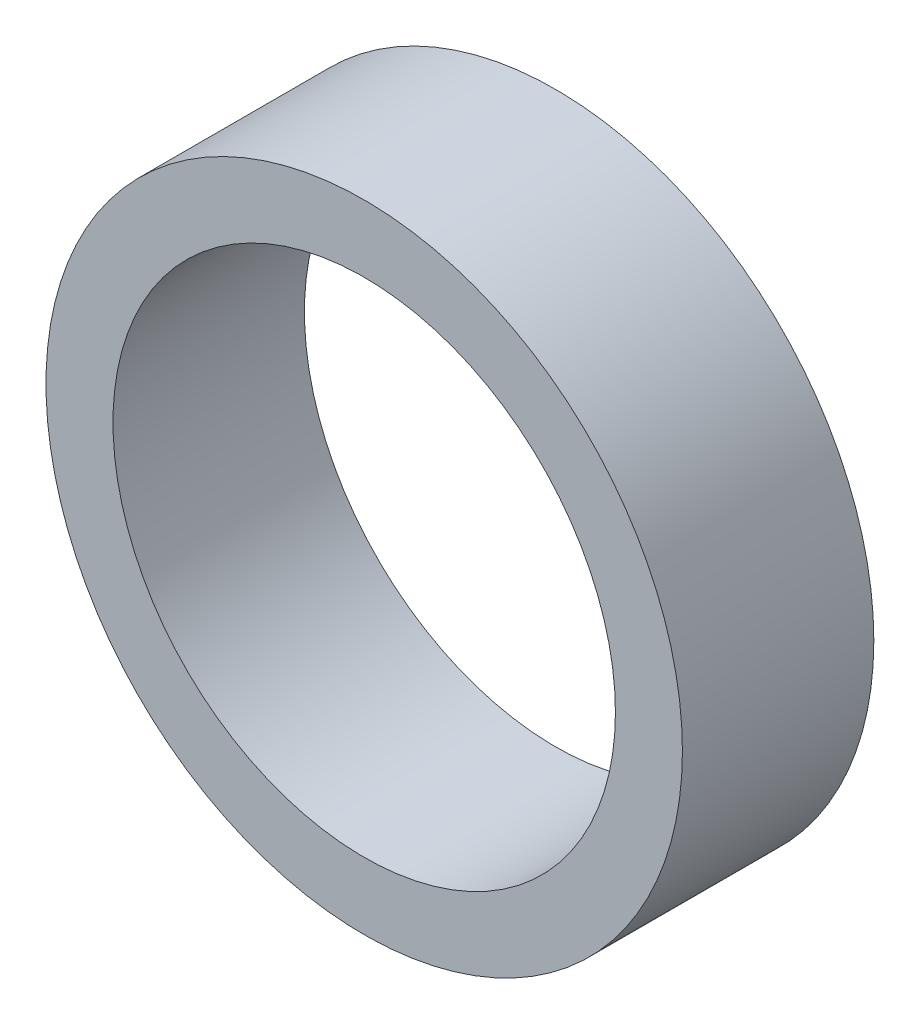
from build123d import *

# Parameters (mm, degrees)
BOSS_EXTRUDE1_START = 5
SKETCH1_R           = 3.325
SKETCH1_R_2         = 2.625
BOSS_EXTRUDE1_DEPTH = 2


with BuildPart() as part:
    # Sketch1 → Boss-Extrude1 (new body)
    with BuildSketch(Plane.XY.offset(3).offset(BOSS_EXTRUDE1_START)):
        with Locations((32.5, 0)):
            Circle(SKETCH1_R)
        with Locations((32.5, 0)):
            Circle(SKETCH1_R_2, mode=Mode.SUBTRACT)
    extrude(amount=BOSS_EXTRUDE1_DEPTH)


solid = part.part
